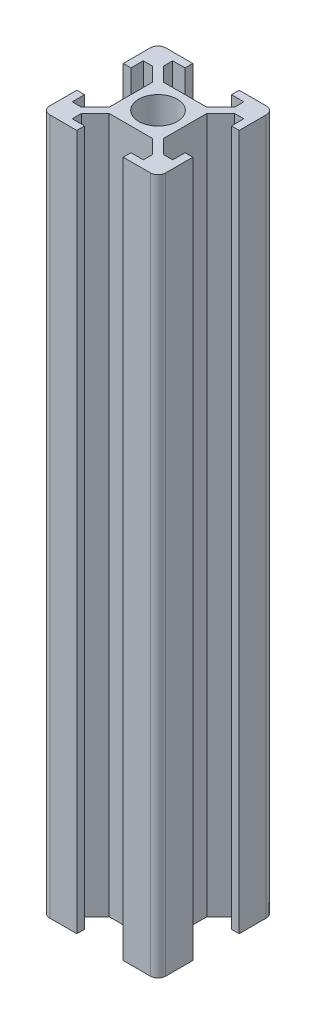
from build123d import *

# Parameters (mm, degrees)
BOSS_EXTRUDE1_DEPTH = 90


with BuildPart() as part:
    # Sketch1 → Boss-Extrude1 (new body)
    with BuildSketch(Plane(origin=(0, 0, 0), x_dir=(1, 0, 0), z_dir=(0, 1, 0))):
        with BuildLine():
            Line((-7.5, -3), (-7.5, -6.5))
            ThreePointArc((-7.5, -6.5), (-7.207106781, -7.207106781), (-6.5, -7.5))
            Line((-6.5, -7.5), (-3, -7.5))
            Line((-3, -7.5), (-3, -6.5))
            Line((-3, -6.5), (-4.6, -6.5))
            Line((-4.6, -6.5), (-4.6, -5.307106781))
            Line((-4.6, -5.307106781), (-2.8, -3.507106781))
            Line((-2.8, -3.507106781), (0, -3.507106781))
            Line((0, -3.507106781), (2.8, -3.507106781))
            Line((2.8, -3.507106781), (4.6, -5.307106781))
            Line((4.6, -5.307106781), (4.6, -6.5))
            Line((4.6, -6.5), (3, -6.5))
            Line((3, -6.5), (3, -7.5))
            Line((3, -7.5), (6.5, -7.5))
            ThreePointArc((6.5, -7.5), (7.207106781, -7.207106781), (7.5, -6.5))
            Line((7.5, -6.5), (7.5, -3))
            Line((7.5, -3), (6.5, -3))
            Line((6.5, -3), (6.5, -4.6))
            Line((6.5, -4.6), (5.307106781, -4.6))
            Line((5.307106781, -4.6), (3.507106781, -2.8))
            Line((3.507106781, -2.8), (3.507106781, 0))
            Line((3.507106781, 0), (3.507106781, 2.8))
            Line((3.507106781, 2.8), (5.307106781, 4.6))
            Line((5.307106781, 4.6), (6.5, 4.6))
            Line((6.5, 4.6), (6.5, 3))
            Line((6.5, 3), (7.5, 3))
            Line((7.5, 3), (7.5, 6.5))
            ThreePointArc((7.5, 6.5), (7.207106781, 7.207106781), (6.5, 7.5))
            Line((6.5, 7.5), (3, 7.5))
            Line((3, 7.5), (3, 6.5))
            Line((3, 6.5), (4.6, 6.5))
            Line((4.6, 6.5), (4.6, 5.307106781))
            Line((4.6, 5.307106781), (2.8, 3.507106781))
            Line((2.8, 3.507106781), (0, 3.507106781))
            Line((0, 3.507106781), (-2.8, 3.507106781))
            Line((-2.8, 3.507106781), (-4.6, 5.307106781))
            Line((-4.6, 5.307106781), (-4.6, 6.5))
            Line((-4.6, 6.5), (-3, 6.5))
            Line((-3, 6.5), (-3, 7.5))
            Line((-3, 7.5), (-6.5, 7.5))
            ThreePointArc((-6.5, 7.5), (-7.207106781, 7.207106781), (-7.5, 6.5))
            Line((-7.5, 6.5), (-7.5, 3))
            Line((-7.5, 3), (-6.5, 3))
            Line((-6.5, 3), (-6.5, 4.6))
            Line((-6.5, 4.6), (-5.307106781, 4.6))
            Line((-5.307106781, 4.6), (-3.507106781, 2.8))
            Line((-3.507106781, 2.8), (-3.507106781, 0))
            Line((-3.507106781, 0), (-3.507106781, -2.8))
            Line((-3.507106781, -2.8), (-5.307106781, -4.6))
            Line((-5.307106781, -4.6), (-6.5, -4.6))
            Line((-6.5, -4.6), (-6.5, -3))
            Line((-6.5, -3), (-7.5, -3))
        make_face()
        with BuildLine():
            ThreePointArc((-2.5, 0), (-1.767766953, -1.767766953), (0, -2.5))
            ThreePointArc((0, -2.5), (1.767766953, -1.767766953), (2.5, 0))
            ThreePointArc((2.5, 0), (1.767766953, 1.767766953), (0, 2.5))
            ThreePointArc((0, 2.5), (-1.767766953, 1.767766953), (-2.5, 0))
        make_face(mode=Mode.SUBTRACT)
    extrude(amount=BOSS_EXTRUDE1_DEPTH)


solid = part.part
